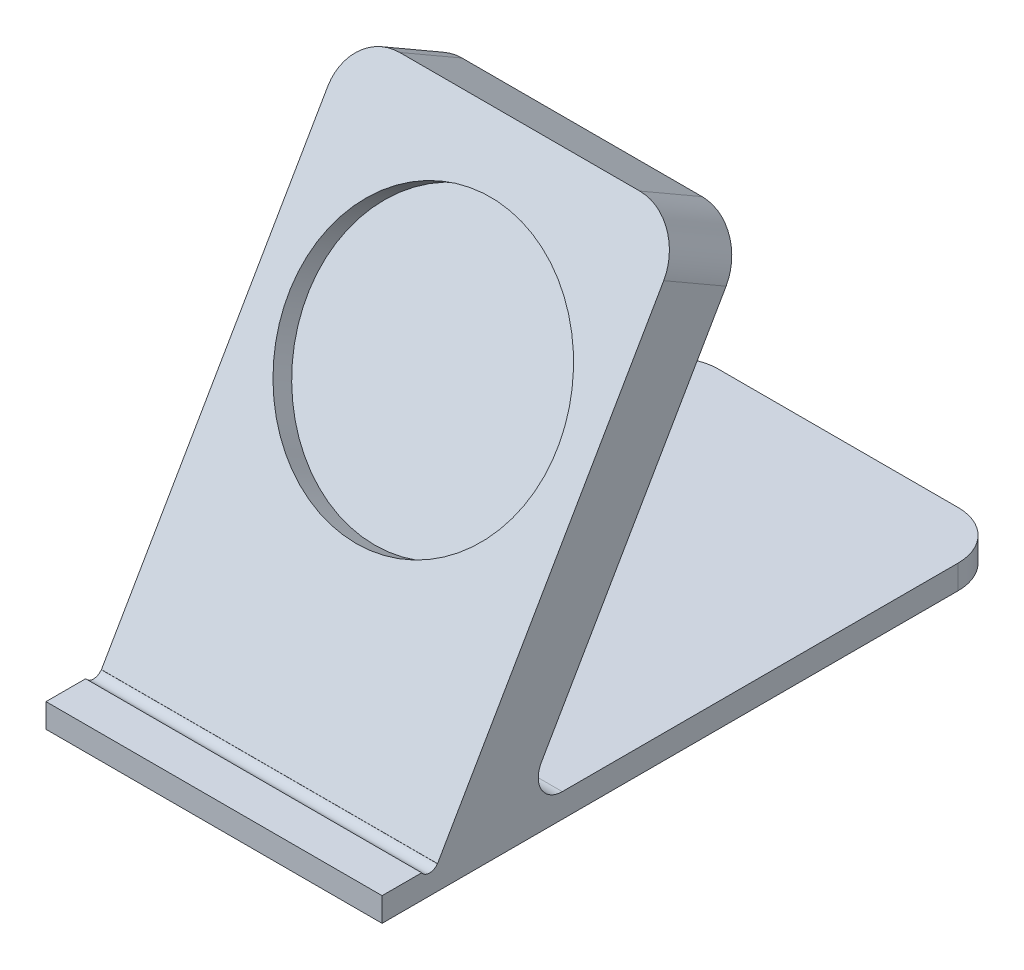
from build123d import *

# Parameters (mm, degrees)
EXTRUDE_1_DEPTH     = 5
EXTRUDE_3_DEPTH     = 15
SKETCH_9_W          = 119.641605024
SKETCH_9_H          = 10.286902638
CUT_EXTRUDE_2_DEPTH = 165.924225025
SKETCH_10_R         = 1.982942862
CUT_EXTRUDE_3_DEPTH = 135.907375632
EXTRUDE_5_DEPTH     = 70
SKETCH_14_R         = 28
CUT_EXTRUDE_5_DEPTH = 4.5


with BuildPart() as part:
    # 草图1 → 凸台-拉伸1 (new body)
    with BuildSketch(Plane(origin=(0, 0, 0), x_dir=(1, 0, 0), z_dir=(0, 1, 0))):
        with BuildLine():
            Line((-25, 65), (25, 65))
            ThreePointArc((25, 65), (32.071067812, 62.071067812), (35, 55))
            Line((35, 55), (35, -65))
            Line((35, -65), (-35, -65))
            Line((-35, -65), (-35, 55))
            ThreePointArc((-35, 55), (-32.071067812, 62.071067812), (-25, 65))
        make_face()
    extrude(amount=EXTRUDE_1_DEPTH)

    # 草图8 → 凸台-拉伸3 (add)
    with BuildSketch(Plane(origin=(0, 24.395825623, 42.254809472), x_dir=(1, 0, 0), z_dir=(0, 0.499999999999998, 0.8660254037844398))):
        with BuildLine():
            ThreePointArc((25, 81.830127019), (32.071067812, 78.901194831), (35, 71.830127019))
            Line((35, 71.830127019), (35, -28.169872981))
            Line((35, -28.169872981), (-35, -28.169872981))
            Line((-35, -28.169872981), (-35, 71.830127019))
            ThreePointArc((-35, 71.830127019), (-32.071067812, 78.901194831), (-25, 81.830127019))
            Line((-25, 81.830127019), (25, 81.830127019))
        make_face()
    extrude(amount=-EXTRUDE_3_DEPTH)

    # 草图9 → 切除-拉伸2 (cut, through all)
    with BuildSketch(Plane.XY.offset(65)):
        with Locations((24.820802512, -5.143451319)):
            Rectangle(SKETCH_9_W, SKETCH_9_H)
    extrude(amount=-CUT_EXTRUDE_2_DEPTH, mode=Mode.SUBTRACT)

    # 草图10 → 切除-拉伸3 (cut, through all)
    with BuildSketch(Plane.ZY.offset(35)):
        with Locations((55.11669843, 6.123569619)):
            Circle(SKETCH_10_R)
    extrude(amount=-CUT_EXTRUDE_3_DEPTH, mode=Mode.SUBTRACT)

    # 草图13 → 凸台-拉伸5 (add)
    with BuildSketch(Plane(origin=(35, 0, 0), x_dir=(0, 0, -1), z_dir=(1, 0, 0))):
        with BuildLine():
            Line((-31.802359522, 12.5), (-36.132486541, 5))
            Line((-36.132486541, 5), (-27.472232503, 5))
            ThreePointArc((-27.472232503, 5), (-31.802359522, 7.5), (-31.802359522, 12.5))
        make_face()
    extrude(amount=-EXTRUDE_5_DEPTH)

    # 草图14 → 切除-拉伸5 (cut)
    with BuildSketch(Plane(origin=(0, 24.395825623, 42.254809472), x_dir=(1, 0, 0), z_dir=(0, 0.49999999999999806, 0.8660254037844398))):
        with Locations(Location((0, 41.66372629, 0), (0, 0, 270))):
            Circle(SKETCH_14_R)
    extrude(amount=-CUT_EXTRUDE_5_DEPTH, mode=Mode.SUBTRACT)


solid = part.part
